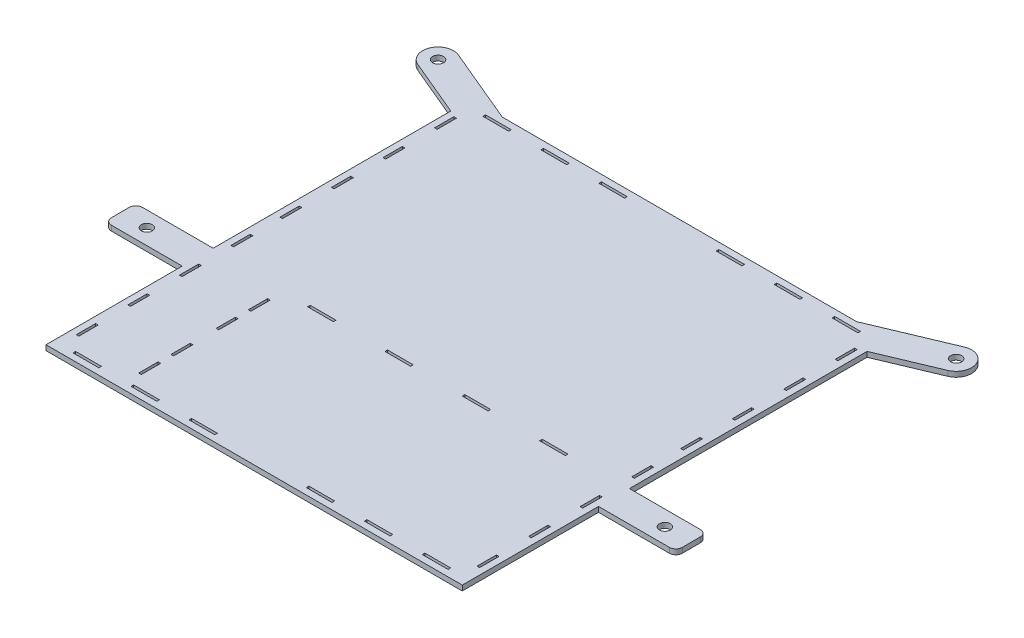
from build123d import *

# Parameters (mm, degrees)
SKETCH1_R           = 4.25
SKETCH1_W           = 2
SKETCH1_H           = 15
SKETCH1_W_2         = 20
SKETCH1_H_2         = 2
BOSS_EXTRUDE1_DEPTH = 4


with BuildPart() as part:
    # Sketch1 → Boss-Extrude1 (new body)
    with BuildSketch(Plane(origin=(0, 0, 0), x_dir=(1, 0, 0), z_dir=(0, 1, 0))):
        with BuildLine():
            Line((-161.5, -165), (161.5, -165))
            Line((161.5, -165), (161.5, -59.29))
            Line((161.5, -59.29), (216.5, -59.29))
            ThreePointArc((216.5, -59.29), (220.035533906, -57.825533906), (221.5, -54.29))
            Line((221.5, -54.29), (221.5, -47.29))
            Line((221.5, -47.29), (221.5, -40.29))
            ThreePointArc((221.5, -40.29), (220.035533906, -36.754466094), (216.5, -35.29))
            Line((216.5, -35.29), (161.5, -35.29))
            Line((161.5, -35.29), (161.5, 149.084720808))
            Line((161.5, 149.084720808), (205.651015663, 167.64799054))
            ThreePointArc((205.651015663, 167.64799054), (212.06200946, 183.361015663), (196.348984337, 189.77200946))
            Line((196.348984337, 189.77200946), (137.431056973, 165))
            Line((137.431056973, 165), (-137.431056973, 165))
            Line((-137.431056973, 165), (-196.348984337, 189.77200946))
            ThreePointArc((-196.348984337, 189.77200946), (-212.06200946, 183.361015663), (-205.651015663, 167.64799054))
            Line((-205.651015663, 167.64799054), (-161.5, 149.084720808))
            Line((-161.5, 149.084720808), (-161.5, -35.29))
            Line((-161.5, -35.29), (-216.5, -35.29))
            ThreePointArc((-216.5, -35.29), (-220.035533906, -36.754466094), (-221.5, -40.29))
            Line((-221.5, -40.29), (-221.5, -47.29))
            Line((-221.5, -47.29), (-221.5, -54.29))
            ThreePointArc((-221.5, -54.29), (-220.035533906, -57.825533906), (-216.5, -59.29))
            Line((-216.5, -59.29), (-161.5, -59.29))
            Line((-161.5, -59.29), (-161.5, -165))
        make_face()
        with Locations(Location((-201, -47.29, 0), (0, 0, 270))):
            Circle(SKETCH1_R, mode=Mode.SUBTRACT)
        with Locations(Location((201, -47.29, 0), (0, 0, 90))):
            Circle(SKETCH1_R, mode=Mode.SUBTRACT)
        with Locations(Location((-201, 178.71, 0), (0, 0, 270))):
            Circle(SKETCH1_R, mode=Mode.SUBTRACT)
        with Locations(Location((201, 178.71, 0), (0, 0, 270))):
            Circle(SKETCH1_R, mode=Mode.SUBTRACT)
        with Locations((155.5, 99)):
            Rectangle(SKETCH1_W, SKETCH1_H, mode=Mode.SUBTRACT)
        with Locations((155.5, 139)):
            Rectangle(SKETCH1_W, SKETCH1_H, mode=Mode.SUBTRACT)
        with Locations((155.5, 59)):
            Rectangle(SKETCH1_W, SKETCH1_H, mode=Mode.SUBTRACT)
        with Locations((155.5, 19)):
            Rectangle(SKETCH1_W, SKETCH1_H, mode=Mode.SUBTRACT)
        with Locations((90.5, 159)):
            Rectangle(SKETCH1_W_2, SKETCH1_H_2, mode=Mode.SUBTRACT)
        with Locations((135.5, 159)):
            Rectangle(SKETCH1_W_2, SKETCH1_H_2, mode=Mode.SUBTRACT)
        with Locations((45.5, 159)):
            Rectangle(SKETCH1_W_2, SKETCH1_H_2, mode=Mode.SUBTRACT)
        with Locations((-45.5, 159)):
            Rectangle(SKETCH1_W_2, SKETCH1_H_2, mode=Mode.SUBTRACT)
        with Locations((-135.5, 159)):
            Rectangle(SKETCH1_W_2, SKETCH1_H_2, mode=Mode.SUBTRACT)
        with Locations((-90.5, 159)):
            Rectangle(SKETCH1_W_2, SKETCH1_H_2, mode=Mode.SUBTRACT)
        with Locations((-155.5, 59)):
            Rectangle(SKETCH1_W, SKETCH1_H, mode=Mode.SUBTRACT)
        with Locations((-155.5, 19)):
            Rectangle(SKETCH1_W, SKETCH1_H, mode=Mode.SUBTRACT)
        with Locations((-155.5, 99)):
            Rectangle(SKETCH1_W, SKETCH1_H, mode=Mode.SUBTRACT)
        with Locations((-155.5, 139)):
            Rectangle(SKETCH1_W, SKETCH1_H, mode=Mode.SUBTRACT)
        with Locations((-155.5, -99)):
            Rectangle(SKETCH1_W, SKETCH1_H, mode=Mode.SUBTRACT)
        with Locations((-135.5, -159)):
            Rectangle(SKETCH1_W_2, SKETCH1_H_2, mode=Mode.SUBTRACT)
        with Locations((-155.5, -139)):
            Rectangle(SKETCH1_W, SKETCH1_H, mode=Mode.SUBTRACT)
        with Locations((-155.5, -59)):
            Rectangle(SKETCH1_W, SKETCH1_H, mode=Mode.SUBTRACT)
        with Locations((-155.5, -19)):
            Rectangle(SKETCH1_W, SKETCH1_H, mode=Mode.SUBTRACT)
        with Locations((-90.5, -159)):
            Rectangle(SKETCH1_W_2, SKETCH1_H_2, mode=Mode.SUBTRACT)
        with Locations((-45.5, -159)):
            Rectangle(SKETCH1_W_2, SKETCH1_H_2, mode=Mode.SUBTRACT)
        with Locations((155.5, -19)):
            Rectangle(SKETCH1_W, SKETCH1_H, mode=Mode.SUBTRACT)
        with Locations((155.5, -59)):
            Rectangle(SKETCH1_W, SKETCH1_H, mode=Mode.SUBTRACT)
        with Locations((155.5, -99)):
            Rectangle(SKETCH1_W, SKETCH1_H, mode=Mode.SUBTRACT)
        with Locations((155.5, -139)):
            Rectangle(SKETCH1_W, SKETCH1_H, mode=Mode.SUBTRACT)
        with Locations((135.5, -159)):
            Rectangle(SKETCH1_W_2, SKETCH1_H_2, mode=Mode.SUBTRACT)
        with Locations((90.5, -159)):
            Rectangle(SKETCH1_W_2, SKETCH1_H_2, mode=Mode.SUBTRACT)
        with Locations((45.5, -159)):
            Rectangle(SKETCH1_W_2, SKETCH1_H_2, mode=Mode.SUBTRACT)
        with Locations((104.5, -37)):
            Rectangle(SKETCH1_W_2, SKETCH1_H_2, mode=Mode.SUBTRACT)
        with Locations((44.5, -37)):
            Rectangle(SKETCH1_W_2, SKETCH1_H_2, mode=Mode.SUBTRACT)
        with Locations((-15.5, -37)):
            Rectangle(SKETCH1_W_2, SKETCH1_H_2, mode=Mode.SUBTRACT)
        with Locations((-75.5, -37)):
            Rectangle(SKETCH1_W_2, SKETCH1_H_2, mode=Mode.SUBTRACT)
        with Locations((-105.5, -80.5)):
            Rectangle(SKETCH1_W, SKETCH1_H, mode=Mode.SUBTRACT)
        with Locations((-105.5, -140.5)):
            Rectangle(SKETCH1_W, SKETCH1_H, mode=Mode.SUBTRACT)
        with Locations((-105.5, -115.5)):
            Rectangle(SKETCH1_W, SKETCH1_H, mode=Mode.SUBTRACT)
        with Locations((-105.5, -55.5)):
            Rectangle(SKETCH1_W, SKETCH1_H, mode=Mode.SUBTRACT)
    extrude(amount=BOSS_EXTRUDE1_DEPTH)


solid = part.part
